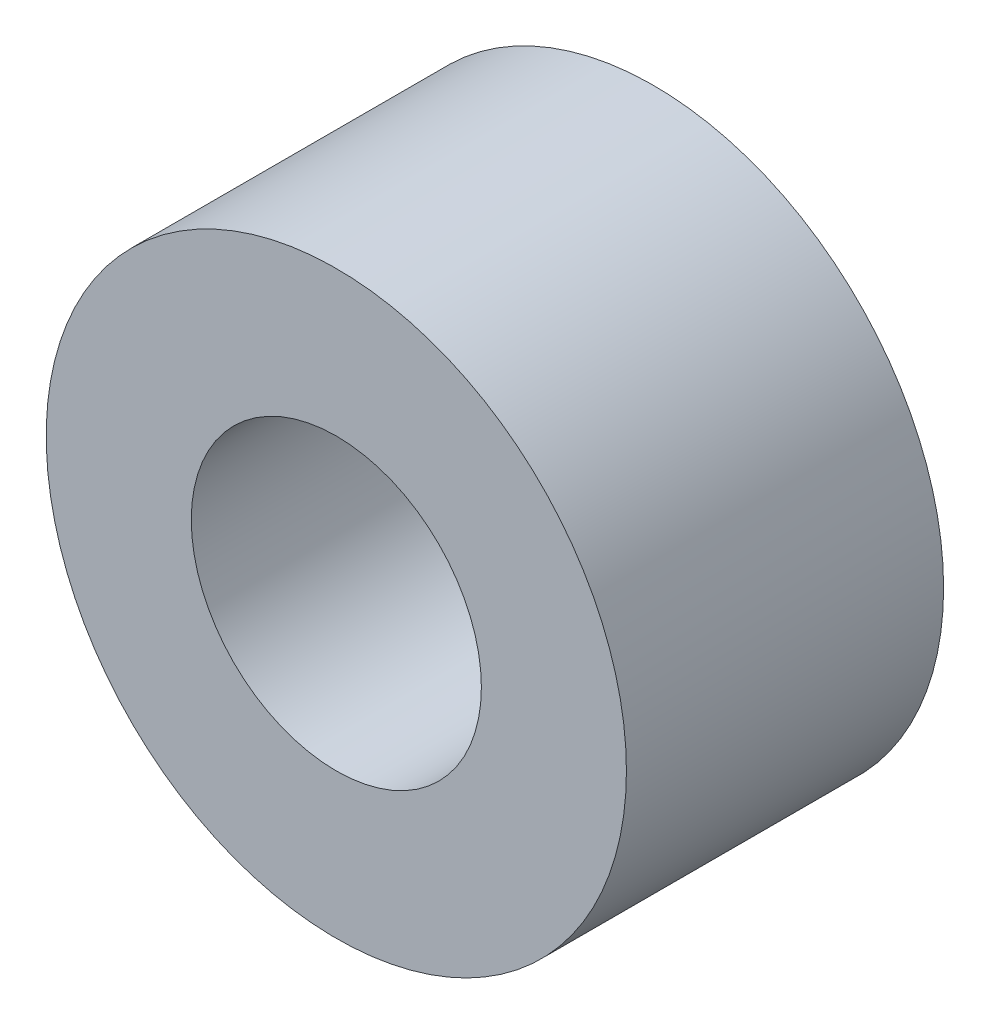
from build123d import *

# Parameters (mm, degrees)
SKETCH1_R           = 4.7625
SKETCH1_R_2         = 2.38125
BOSS_EXTRUDE1_DEPTH = 5.207


with BuildPart() as part:
    # Sketch1 → Boss-Extrude1 (new body)
    with BuildSketch(Plane.XY):
        Circle(SKETCH1_R)
        Circle(SKETCH1_R_2, mode=Mode.SUBTRACT)
    extrude(amount=BOSS_EXTRUDE1_DEPTH)


solid = part.part
